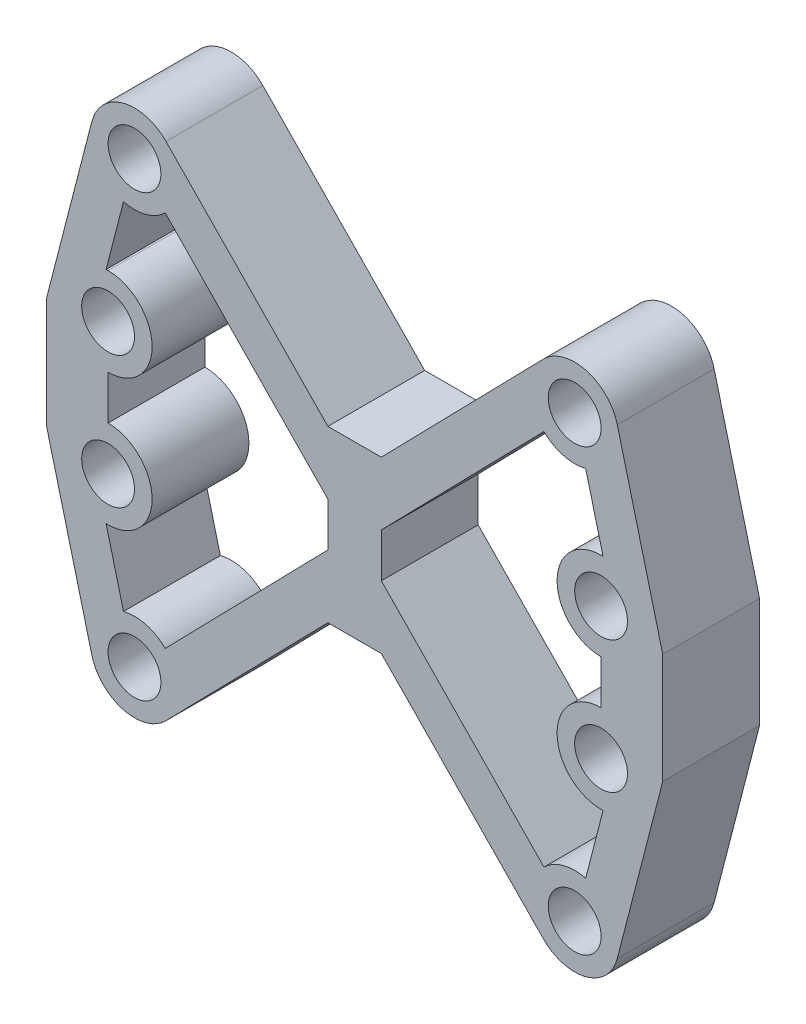
from build123d import *

# Parameters (mm, degrees)
BOSS_EXTRUDE1_DEPTH = 6.985
SKETCH3_R           = 1.905
CUT_EXTRUDE1_DEPTH  = 31.093908852


with BuildPart() as part:
    # Sketch1 → Boss-Extrude1 (new body)
    with BuildSketch(Plane.XY):
        with BuildLine():
            Line((-5.23875, -9.525), (-13.603110789, -18.092914429))
            ThreePointArc((-13.603110789, -18.092914429), (-16.692674217, -18.942903824), (-18.949374194, -16.66799957))
            Line((-18.949374194, -16.66799957), (-22.225, -3.96875))
            Line((-22.225, -3.96875), (-22.225, 3.96875))
            Line((-22.225, 3.96875), (-18.949374194, 16.66799957))
            ThreePointArc((-18.949374194, 16.66799957), (-16.692674217, 18.942903824), (-13.603110789, 18.092914429))
            Line((-13.603110789, 18.092914429), (-5.23875, 9.525))
            Line((-5.23875, 9.525), (5.23875, 9.525))
            Line((5.23875, 9.525), (13.603110789, 18.092914429))
            ThreePointArc((13.603110789, 18.092914429), (16.692674217, 18.942903824), (18.949374194, 16.66799957))
            Line((18.949374194, 16.66799957), (22.225, 3.96875))
            Line((22.225, 3.96875), (22.225, -3.96875))
            Line((22.225, -3.96875), (18.949374194, -16.66799957))
            ThreePointArc((18.949374194, -16.66799957), (16.692674217, -18.942903824), (13.603110789, -18.092914429))
            Line((13.603110789, -18.092914429), (5.23875, -9.525))
            Line((5.23875, -9.525), (-5.23875, -9.525))
        make_face()
    extrude(amount=BOSS_EXTRUDE1_DEPTH)

    # Sketch3 → Cut-Extrude1 (cut, through all)
    with BuildSketch(Plane.XY.offset(6.985)):
        with Locations((-15.875, 15.875)):
            Circle(SKETCH3_R)
        with Locations((-17.78, 4.7625)):
            Circle(SKETCH3_R)
        with Locations(Location((17.78, 4.7625, 0), (0, 0, 180))):
            Circle(SKETCH3_R)
        with Locations((17.78, -4.7625)):
            Circle(SKETCH3_R)
        with Locations(Location((-17.78, -4.7625, 0), (0, 0, 180))):
            Circle(SKETCH3_R)
        with Locations(Location((15.875, 15.875, 0), (0, 0, 180))):
            Circle(SKETCH3_R)
        with Locations((15.875, -15.875)):
            Circle(SKETCH3_R)
        with Locations(Location((-15.875, -15.875, 0), (0, 0, 180))):
            Circle(SKETCH3_R)
        Polygon((-1.926937637, 6.132591943), (1.926937637, 6.132591943), (5.23875, 9.525), (-5.23875, 9.525), align=None)
        with BuildLine():
            Line((-17.922387107, 7.9375), (-16.66799957, 12.800625806))
            ThreePointArc((-16.66799957, 12.800625806), (-15.057325783, 12.807096176), (-13.657085571, 13.603110789))
            Line((-13.657085571, 13.603110789), (-1.926937637, 1.5875))
            Line((-1.926937637, 1.5875), (-1.926937637, -1.5875))
            Line((-1.926937637, -1.5875), (-13.657085571, -13.603110789))
            ThreePointArc((-13.657085571, -13.603110789), (-15.057325783, -12.807096176), (-16.66799957, -12.800625806))
            Line((-16.66799957, -12.800625806), (-17.922387107, -7.9375))
            Line((-17.922387107, -7.9375), (-17.78, -7.9375))
            ThreePointArc((-17.78, -7.9375), (-14.605, -4.7625), (-17.78, -1.5875))
            Line((-17.78, -1.5875), (-17.78, 1.5875))
            ThreePointArc((-17.78, 1.5875), (-14.605, 4.7625), (-17.78, 7.9375))
            Line((-17.78, 7.9375), (-17.922387107, 7.9375))
        make_face()
        with BuildLine():
            Line((17.922387107, -7.9375), (16.66799957, -12.800625806))
            ThreePointArc((16.66799957, -12.800625806), (15.057325783, -12.807096176), (13.657085571, -13.603110789))
            Line((13.657085571, -13.603110789), (1.926937637, -1.5875))
            Line((1.926937637, -1.5875), (1.926937637, 1.5875))
            Line((1.926937637, 1.5875), (13.657085571, 13.603110789))
            ThreePointArc((13.657085571, 13.603110789), (15.057325783, 12.807096176), (16.66799957, 12.800625806))
            Line((16.66799957, 12.800625806), (17.922387107, 7.9375))
            Line((17.922387107, 7.9375), (17.78, 7.9375))
            ThreePointArc((17.78, 7.9375), (14.605, 4.7625), (17.78, 1.5875))
            Line((17.78, 1.5875), (17.78, -1.5875))
            ThreePointArc((17.78, -1.5875), (14.605, -4.7625), (17.78, -7.9375))
            Line((17.78, -7.9375), (17.922387107, -7.9375))
        make_face()
        Polygon((-5.23875, -9.525), (5.23875, -9.525), (1.926937637, -6.132591943), (-1.926937637, -6.132591943), align=None)
    extrude(amount=-CUT_EXTRUDE1_DEPTH, mode=Mode.SUBTRACT)


solid = part.part
